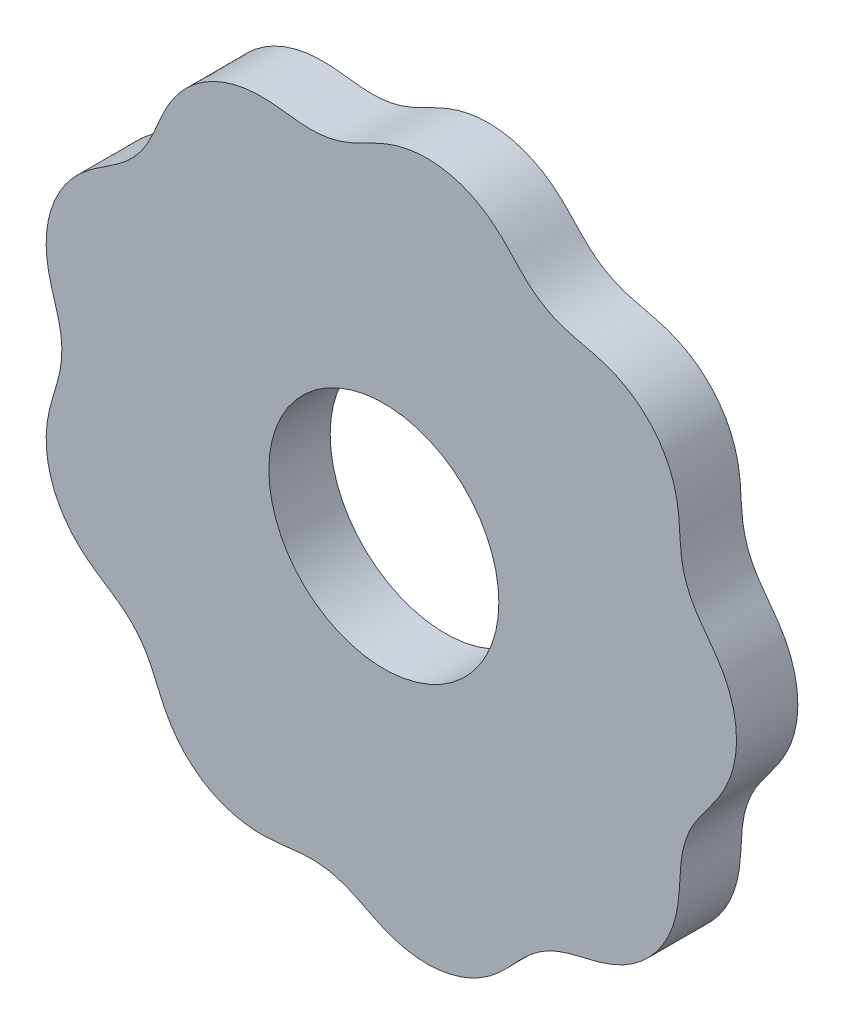
from build123d import *

# Parameters (mm, degrees)
LOBEBASE_DEPTH      = 2
LOBEBASE_DEPTH_BACK = 2
LOBEBASESKETCH_R    = 7.5


with BuildPart() as part:
    # LobeBaseSketch → LobeBase (new, two sides: drawn at the far end of the back side and taken through both)
    with BuildSketch(Plane.XY.offset(-LOBEBASE_DEPTH_BACK)):
        with BuildLine():
            add(Edge.make_bspline(
                [(23, 0), (23, 0.141257378), (22.991214811, 0.423093299), (22.951959723, 0.842541102), (22.887551194, 1.254853134), (22.799455849, 1.65684625), (22.68961115, 2.045790087), (22.56031143, 2.419544313), (22.41406411, 2.776686537), (22.253418624, 3.116631798), (22.080772267, 3.43974694), (21.898160881, 3.747466212), (21.707050311, 4.042417283), (21.50816113, 4.328567478), (21.301391185, 4.611391979), (21.085955306, 4.898034365), (20.860934059, 5.197346764), (20.626457431, 5.519529016), (20.385571408, 5.874860002), (20.1461799, 6.270981099), (19.921410262, 6.70892741), (19.726557577, 7.179879783), (19.573101044, 7.665899121), (19.463778114, 8.145864598), (19.392540915, 8.603188859), (19.348667959, 9.030226737), (19.321192717, 9.427751332), (19.301174692, 9.801678801), (19.281957976, 10.159739122), (19.258556858, 10.509304418), (19.22698101, 10.856351686), (19.183789306, 11.205140822), (19.125879608, 11.558247796), (19.050439981, 11.916743295), (18.954988961, 12.2804174), (18.837454311, 12.648010182), (18.696259058, 13.017434788), (18.530396699, 13.385989865), (18.339485455, 13.750561053), (18.123796186, 14.107811399), (17.884251477, 14.454359742), (17.622395219, 14.786945329), (17.340333216, 15.102576283), (17.040646223, 15.398659258), (16.726277362, 15.673107594), (16.400396219, 15.92442559), (16.066242018, 16.151767044), (15.726948101, 16.354967133), (15.385349557, 16.534547984), (15.043775374, 16.691700235), (14.703826181, 16.828245855), (14.366139608, 16.946592157), (14.030149524, 17.049694279), (13.693857773, 17.141054545), (13.353666721, 17.224801524), (13.004383088, 17.305902817), (12.639612511, 17.390548547), (12.252898234, 17.4866358), (11.839966479, 17.603996576), (11.401960211, 17.753565046), (10.948270216, 17.944572246), (10.496282051, 18.180093802), (10.066320317, 18.453766258), (9.674058232, 18.751169719), (9.325525004, 19.055710039), (9.017421713, 19.35463904), (8.740850572, 19.641499802), (8.485159931, 19.915077523), (8.240282334, 20.177015375), (7.997659797, 20.42975598), (7.750393611, 20.675313047), (7.493109511, 20.914737933), (7.221775321, 21.148009933), (6.933548749, 21.37414176), (6.626663816, 21.591377554), (6.300342965, 21.797420146), (5.954719567, 21.989657253), (5.590758992, 22.165372552), (5.210170652, 22.321934903), (4.81530699, 22.456962155), (4.409048116, 22.568457217), (3.99467269, 22.6549146), (3.575716993, 22.715395978), (3.15582497, 22.749573609), (2.73859246, 22.757740823), (2.327408928, 22.740789216), (1.92529969, 22.700152694), (1.53477097, 22.637719067), (1.157658957, 22.555710669), (0.794982433, 22.456536624), (0.44679641, 22.342621509), (0.112041951, 22.216219291), (-0.211614153, 22.079229836), (-0.527953827, 21.933051689), (-0.842386812, 21.778535003), (-1.162084504, 21.616147007), (-1.495924204, 21.446519391), (-1.853928223, 21.271551351), (-2.245690352, 21.096027506), (-2.677363379, 20.929058599), (-3.14768714, 20.783752295), (-3.645320501, 20.673639883), (-4.150603561, 20.606911071), (-4.642261011, 20.582594132), (-5.105007699, 20.591852711), (-5.533176371, 20.622800634), (-5.9294327, 20.664772224), (-6.301155464, 20.709990141), (-6.657112992, 20.753241892), (-7.005431167, 20.790897667), (-7.352689095, 20.820065652), (-7.703679501, 20.838096725), (-8.0614779, 20.842383188), (-8.427627001, 20.830341748), (-8.802350975, 20.799492189), (-9.184768875, 20.747574972), (-9.573099389, 20.672674702), (-9.964856982, 20.573331082), (-10.357040904, 20.448627331), (-10.746317863, 20.298250738), (-11.12919786, 20.12252274), (-11.502201587, 19.922397548), (-11.862016951, 19.699429441), (-12.20564186, 19.455709636), (-12.530510289, 19.193774197), (-12.834598867, 18.916484833), (-13.116511761, 18.626884615), (-13.375542555, 18.328030659), (-13.611713134, 18.022805652), (-13.825791623, 17.71370995), (-14.019294366, 17.402636248), (-14.19448138, 17.090630513), (-14.354361216, 16.777648369), (-14.502729963, 16.462330188), (-14.644278193, 16.141849913), (-14.784799842, 15.811955775), (-14.931501359, 15.46742546), (-15.09328106, 15.103271618), (-15.28056371, 14.716992709), (-15.503918888, 14.311613033), (-15.7708067, 13.89798366), (-16.081237077, 13.4937601), (-16.425413904, 13.117853174), (-16.786414735, 12.783194001), (-17.146850563, 12.492838647), (-17.494739736, 12.241324613), (-17.825268513, 12.018768058), (-18.139090188, 11.814468205), (-18.439571164, 11.61879588), (-18.730603032, 11.42374727), (-19.015366858, 11.22287815), (-19.295831257, 11.011078469), (-19.572676019, 10.784373713), (-19.845422414, 10.539793329), (-20.112647918, 10.275293268), (-20.372225281, 9.989708885), (-20.621558748, 9.682717906), (-20.857805627, 9.354799352), (-21.078077916, 9.00717977), (-21.279621156, 8.641762211), (-21.45996847, 8.261036236), (-21.617067909, 7.867969271), (-21.749381332, 7.465880934), (-21.855953213, 7.058302898), (-21.936448013, 6.648827309), (-21.991155211, 6.240946963), (-22.020961585, 5.837890209), (-22.027291066, 5.442453013), (-22.012013373, 5.05682957), (-21.977324122, 4.682441525), (-21.925601502, 4.319764078), (-21.859249119, 3.968145777), (-21.780543135, 3.625618767), (-21.69151757, 3.288701435), (-21.593949055, 2.952213852), (-21.489543019, 2.609174707), (-21.380463083, 2.250951255), (-21.270319946, 1.86800324), (-21.165491483, 1.451713463), (-21.076018443, 0.997604673), (-21.014590533, 0.509194012), (-20.992564101, 0), (-21.014590533, -0.509194012), (-21.076018443, -0.997604673), (-21.165491483, -1.451713463), (-21.270319946, -1.86800324), (-21.380463083, -2.250951255), (-21.489543019, -2.609174707), (-21.593949055, -2.952213852), (-21.69151757, -3.288701435), (-21.780543135, -3.625618767), (-21.859249119, -3.968145777), (-21.925601502, -4.319764078), (-21.977324122, -4.682441525), (-22.012013373, -5.05682957), (-22.027291066, -5.442453013), (-22.020961585, -5.837890209), (-21.991155211, -6.240946963), (-21.936448013, -6.648827309), (-21.855953213, -7.058302898), (-21.749381332, -7.465880934), (-21.617067909, -7.867969271), (-21.45996847, -8.261036236), (-21.279621156, -8.641762211), (-21.078077916, -9.00717977), (-20.857805627, -9.354799352), (-20.621558748, -9.682717906), (-20.372225281, -9.989708885), (-20.112647918, -10.275293268), (-19.845422414, -10.539793329), (-19.572676019, -10.784373713), (-19.295831257, -11.011078469), (-19.015366858, -11.22287815), (-18.730603032, -11.42374727), (-18.439571164, -11.61879588), (-18.139090188, -11.814468205), (-17.825268513, -12.018768058), (-17.494739736, -12.241324613), (-17.146850563, -12.492838647), (-16.786414735, -12.783194001), (-16.425413904, -13.117853174), (-16.081237077, -13.4937601), (-15.7708067, -13.89798366), (-15.503918888, -14.311613033), (-15.28056371, -14.716992709), (-15.09328106, -15.103271618), (-14.931501359, -15.46742546), (-14.784799842, -15.811955775), (-14.644278193, -16.141849913), (-14.502729963, -16.462330188), (-14.354361216, -16.777648369), (-14.19448138, -17.090630513), (-14.019294366, -17.402636248), (-13.825791623, -17.71370995), (-13.611713134, -18.022805652), (-13.375542555, -18.328030659), (-13.116511761, -18.626884615), (-12.834598867, -18.916484833), (-12.530510289, -19.193774197), (-12.20564186, -19.455709636), (-11.862016951, -19.699429441), (-11.502201587, -19.922397548), (-11.12919786, -20.12252274), (-10.746317863, -20.298250738), (-10.357040904, -20.448627331), (-9.964856982, -20.573331082), (-9.573099389, -20.672674702), (-9.184768875, -20.747574972), (-8.802350975, -20.799492189), (-8.427627001, -20.830341748), (-8.0614779, -20.842383188), (-7.703679501, -20.838096725), (-7.352689095, -20.820065652), (-7.005431167, -20.790897667), (-6.657112992, -20.753241892), (-6.301155464, -20.709990141), (-5.9294327, -20.664772224), (-5.533176371, -20.622800634), (-5.105007699, -20.591852711), (-4.642261011, -20.582594132), (-4.150603561, -20.606911071), (-3.645320501, -20.673639883), (-3.14768714, -20.783752295), (-2.677363379, -20.929058599), (-2.245690352, -21.096027506), (-1.853928223, -21.271551351), (-1.495924204, -21.446519391), (-1.162084504, -21.616147007), (-0.842386812, -21.778535003), (-0.527953827, -21.933051689), (-0.211614153, -22.079229836), (0.112041951, -22.216219291), (0.44679641, -22.342621509), (0.794982433, -22.456536624), (1.157658957, -22.555710669), (1.53477097, -22.637719067), (1.92529969, -22.700152694), (2.327408928, -22.740789216), (2.73859246, -22.757740823), (3.15582497, -22.749573609), (3.575716993, -22.715395978), (3.99467269, -22.6549146), (4.409048116, -22.568457217), (4.81530699, -22.456962155), (5.210170652, -22.321934903), (5.590758992, -22.165372552), (5.954719567, -21.989657253), (6.300342965, -21.797420146), (6.626663816, -21.591377554), (6.933548749, -21.37414176), (7.221775321, -21.148009933), (7.493109511, -20.914737933), (7.750393611, -20.675313047), (7.997659797, -20.42975598), (8.240282334, -20.177015375), (8.485159931, -19.915077523), (8.740850572, -19.641499802), (9.017421713, -19.35463904), (9.325525004, -19.055710039), (9.674058232, -18.751169719), (10.066320317, -18.453766258), (10.496282051, -18.180093802), (10.948270216, -17.944572246), (11.401960211, -17.753565046), (11.839966479, -17.603996576), (12.252898234, -17.4866358), (12.639612511, -17.390548547), (13.004383088, -17.305902817), (13.353666721, -17.224801524), (13.693857773, -17.141054545), (14.030149524, -17.049694279), (14.366139608, -16.946592157), (14.703826181, -16.828245855), (15.043775374, -16.691700235), (15.385349557, -16.534547984), (15.726948101, -16.354967133), (16.066242018, -16.151767044), (16.400396219, -15.92442559), (16.726277362, -15.673107594), (17.040646223, -15.398659258), (17.340333216, -15.102576283), (17.622395219, -14.786945329), (17.884251477, -14.454359742), (18.123796186, -14.107811399), (18.339485455, -13.750561053), (18.530396699, -13.385989865), (18.696259058, -13.017434788), (18.837454311, -12.648010182), (18.954988961, -12.2804174), (19.050439981, -11.916743295), (19.125879608, -11.558247796), (19.183789306, -11.205140822), (19.22698101, -10.856351686), (19.258556858, -10.509304418), (19.281957976, -10.159739122), (19.301174692, -9.801678801), (19.321192717, -9.427751332), (19.348667959, -9.030226737), (19.392540915, -8.603188859), (19.463778114, -8.145864598), (19.573101044, -7.665899121), (19.726557577, -7.179879783), (19.921410262, -6.70892741), (20.1461799, -6.270981099), (20.385571408, -5.874860002), (20.626457431, -5.519529016), (20.860934059, -5.197346764), (21.085955306, -4.898034365), (21.301391185, -4.611391979), (21.50816113, -4.328567478), (21.707050311, -4.042417283), (21.898160881, -3.747466212), (22.080772267, -3.43974694), (22.253418624, -3.116631798), (22.41406411, -2.776686537), (22.56031143, -2.419544313), (22.68961115, -2.045790087), (22.799455849, -1.65684625), (22.887551194, -1.254853134), (22.951959723, -0.842541102), (22.991214811, -0.423093299), (23, -0.141257378), (23, 0)],
                knots=[0, 0, 0, 0, 0.002930953, 0.00584782, 0.008736981, 0.011585758, 0.014382943, 0.017119384, 0.01978866, 0.022387892, 0.024918708, 0.027388416, 0.029811389, 0.032210624, 0.034619262, 0.03708153, 0.039651896, 0.042390244, 0.045350066, 0.048557974, 0.051989318, 0.055555556, 0.059121793, 0.062553137, 0.065761046, 0.068720867, 0.071459215, 0.074029581, 0.076491849, 0.078900487, 0.081299722, 0.083722695, 0.086192404, 0.088723219, 0.091322451, 0.093991727, 0.096728168, 0.099525353, 0.10237413, 0.105263291, 0.108180158, 0.111111111, 0.114042064, 0.116958931, 0.119848092, 0.122696869, 0.125494054, 0.128230495, 0.130899771, 0.133499003, 0.136029819, 0.138499527, 0.1409225, 0.143321735, 0.145730373, 0.148192641, 0.150763007, 0.153501355, 0.156461177, 0.159669086, 0.163100429, 0.166666667, 0.170232904, 0.173664248, 0.176872157, 0.179831978, 0.182570326, 0.185140692, 0.18760296, 0.190011598, 0.192410833, 0.194833807, 0.197303515, 0.199834331, 0.202433562, 0.205102838, 0.207839279, 0.210636464, 0.213485242, 0.216374402, 0.21929127, 0.222222222, 0.225153175, 0.228070042, 0.230959203, 0.23380798, 0.236605166, 0.239341606, 0.242010882, 0.244610114, 0.24714093, 0.249610638, 0.252033612, 0.254432847, 0.256841484, 0.259303752, 0.261874118, 0.264612466, 0.267572288, 0.270780197, 0.27421154, 0.277777778, 0.281344015, 0.284775359, 0.287983268, 0.290943089, 0.293681437, 0.296251804, 0.298714071, 0.301122709, 0.303521944, 0.305944918, 0.308414626, 0.310945442, 0.313544673, 0.316213949, 0.31895039, 0.321747576, 0.324596353, 0.327485513, 0.330402381, 0.333333333, 0.336264286, 0.339181154, 0.342070314, 0.344919091, 0.347716277, 0.350452717, 0.353121993, 0.355721225, 0.358252041, 0.360721749, 0.363144723, 0.365543958, 0.367952595, 0.370414863, 0.372985229, 0.375723577, 0.378683399, 0.381891308, 0.385322651, 0.388888889, 0.392455126, 0.39588647, 0.399094379, 0.4020542, 0.404792548, 0.407362915, 0.409825182, 0.41223382, 0.414633055, 0.417056029, 0.419525737, 0.422056553, 0.424655784, 0.427325061, 0.430061501, 0.432858687, 0.435707464, 0.438596624, 0.441513492, 0.444444444, 0.447375397, 0.450292265, 0.453181425, 0.456030202, 0.458827388, 0.461563828, 0.464233105, 0.466832336, 0.469363152, 0.47183286, 0.474255834, 0.476655069, 0.479063706, 0.481525974, 0.48409634, 0.486834688, 0.48979451, 0.493002419, 0.496433763, 0.5, 0.503566237, 0.506997581, 0.51020549, 0.513165312, 0.51590366, 0.518474026, 0.520936294, 0.523344931, 0.525744166, 0.52816714, 0.530636848, 0.533167664, 0.535766895, 0.538436172, 0.541172612, 0.543969798, 0.546818575, 0.549707735, 0.552624603, 0.555555556, 0.558486508, 0.561403376, 0.564292536, 0.567141313, 0.569938499, 0.572674939, 0.575344216, 0.577943447, 0.580474263, 0.582943971, 0.585366945, 0.58776618, 0.590174818, 0.592637085, 0.595207452, 0.5979458, 0.600905621, 0.60411353, 0.607544874, 0.611111111, 0.614677349, 0.618108692, 0.621316601, 0.624276423, 0.627014771, 0.629585137, 0.632047405, 0.634456042, 0.636855277, 0.639278251, 0.641747959, 0.644278775, 0.646878007, 0.649547283, 0.652283723, 0.655080909, 0.657929686, 0.660818846, 0.663735714, 0.666666667, 0.669597619, 0.672514487, 0.675403647, 0.678252424, 0.68104961, 0.683786051, 0.686455327, 0.689054558, 0.691585374, 0.694055082, 0.696478056, 0.698877291, 0.701285929, 0.703748196, 0.706318563, 0.709056911, 0.712016732, 0.715224641, 0.718655985, 0.722222222, 0.72578846, 0.729219803, 0.732427712, 0.735387534, 0.738125882, 0.740696248, 0.743158516, 0.745567153, 0.747966388, 0.750389362, 0.75285907, 0.755389886, 0.757989118, 0.760658394, 0.763394834, 0.76619202, 0.769040797, 0.771929958, 0.774846825, 0.777777778, 0.78070873, 0.783625598, 0.786514758, 0.789363536, 0.792160721, 0.794897162, 0.797566438, 0.800165669, 0.802696485, 0.805166193, 0.807589167, 0.809988402, 0.81239704, 0.814859308, 0.817429674, 0.820168022, 0.823127843, 0.826335752, 0.829767096, 0.833333333, 0.836899571, 0.840330914, 0.843538823, 0.846498645, 0.849236993, 0.851807359, 0.854269627, 0.856678265, 0.8590775, 0.861500473, 0.863970181, 0.866500997, 0.869100229, 0.871769505, 0.874505946, 0.877303131, 0.880151908, 0.883041069, 0.885957936, 0.888888889, 0.891819842, 0.894736709, 0.89762587, 0.900474647, 0.903271832, 0.906008273, 0.908677549, 0.911276781, 0.913807596, 0.916277305, 0.918700278, 0.921099513, 0.923508151, 0.925970419, 0.928540785, 0.931279133, 0.934238954, 0.937446863, 0.940878207, 0.944444444, 0.948010682, 0.951442026, 0.954649934, 0.957609756, 0.960348104, 0.96291847, 0.965380738, 0.967789376, 0.970188611, 0.972611584, 0.975081292, 0.977612108, 0.98021134, 0.982880616, 0.985617057, 0.988414242, 0.991263019, 0.99415218, 0.997069047, 1, 1, 1, 1], degree=3))
        make_face()
        Circle(LOBEBASESKETCH_R, mode=Mode.SUBTRACT)
    extrude(amount=LOBEBASE_DEPTH + LOBEBASE_DEPTH_BACK)


solid = part.part
